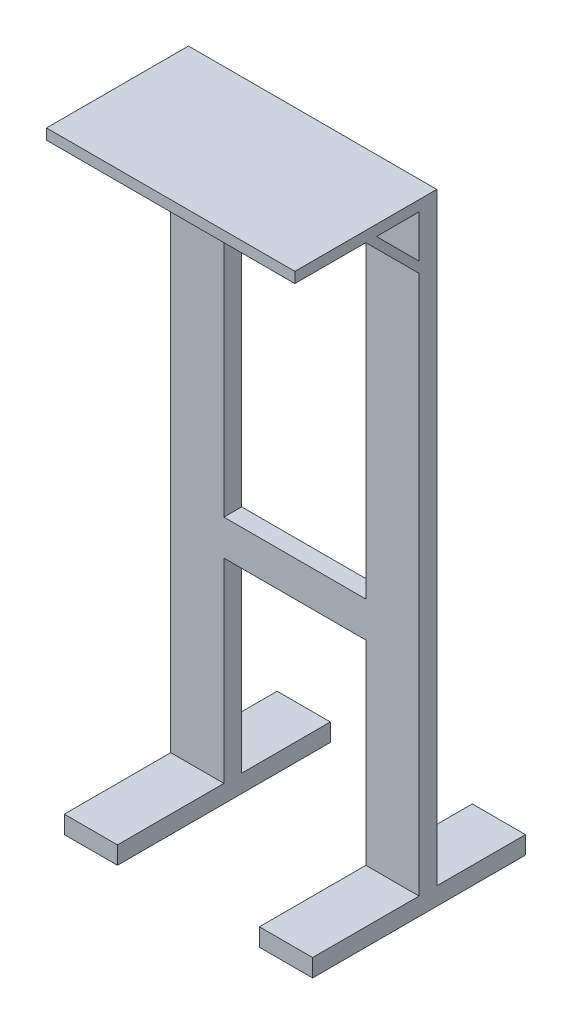
from build123d import *

# Parameters (mm, degrees)
SALIENTE_EXTRUIR1_DEPTH        = 300
SALIENTE_EXTRUIR1_DEPTH_BACK   = 300
CROQUIS1_W                     = 150
CROQUIS1_H                     = 50
SALIENTE_EXTRUIR1_2_DEPTH      = 300
SALIENTE_EXTRUIR1_2_DEPTH_BACK = 300
CROQUIS2_W                     = 150
CROQUIS2_H                     = 50
SALIENTE_EXTRUIR2_DEPTH        = 1700
CROQUIS3_W                     = 700
CROQUIS3_H                     = 100
SALIENTE_EXTRUIR3_DEPTH        = 50
CROQUIS4_W                     = 700
CROQUIS4_H                     = 30
SALIENTE_EXTRUIR4_DEPTH        = 350
SALIENTE_EXTRUIR5_DEPTH        = 15
SALIENTE_EXTRUIR6_DEPTH        = 15


with BuildPart() as part:
    # Croquis1 → Saliente-Extruir1 (new, two sides: drawn at the far end of the back side and taken through both)
    with BuildSketch(Plane.XY.offset(-SALIENTE_EXTRUIR1_DEPTH_BACK)):
        with Locations((75, 25)):
            Rectangle(CROQUIS1_W, CROQUIS1_H)
    extrude(amount=SALIENTE_EXTRUIR1_DEPTH + SALIENTE_EXTRUIR1_DEPTH_BACK)



with BuildPart() as body_2:
    # Croquis1 → Saliente-Extruir1 2 (new, two sides: drawn at the far end of the back side and taken through both)
    with BuildSketch(Plane.XY.offset(-SALIENTE_EXTRUIR1_2_DEPTH_BACK)):
        with Locations((625, 25)):
            Rectangle(CROQUIS1_W, CROQUIS1_H)
    extrude(amount=SALIENTE_EXTRUIR1_2_DEPTH + SALIENTE_EXTRUIR1_2_DEPTH_BACK)


with BuildPart() as part_1:
    add(part.part)

    add(body_2.part)  # Saliente-Extruir2 merges body 2
    # Croquis2 → Saliente-Extruir2 (add)
    with BuildSketch(Plane(origin=(0, 50, 0), x_dir=(1, 0, 0), z_dir=(0, 1, 0))):
        with Locations((75, 25)):
            Rectangle(CROQUIS2_W, CROQUIS2_H)
        with Locations((625, 25)):
            Rectangle(CROQUIS2_W, CROQUIS2_H)
    extrude(amount=SALIENTE_EXTRUIR2_DEPTH)

    # Croquis3 → Saliente-Extruir3 (add)
    with BuildSketch(Plane.XY):
        with Locations((350, 650)):
            Rectangle(CROQUIS3_W, CROQUIS3_H)
        with Locations((350, 1700)):
            Rectangle(CROQUIS3_W, CROQUIS3_H)
    extrude(amount=-SALIENTE_EXTRUIR3_DEPTH)

    # Croquis4 → Saliente-Extruir4 (add)
    with BuildSketch(Plane.XY):
        with Locations((350, 1735)):
            Rectangle(CROQUIS4_W, CROQUIS4_H)
    extrude(amount=SALIENTE_EXTRUIR4_DEPTH)

    # Croquis5 → Saliente-Extruir5 (add)
    with BuildSketch(Plane.ZY):
        Polygon((0, 1570), (150, 1720), (120, 1720), (0, 1600), align=None)
    extrude(amount=-SALIENTE_EXTRUIR5_DEPTH)

    # Croquis6 → Saliente-Extruir6 (add)
    with BuildSketch(Plane(origin=(700, 0, 0), x_dir=(0, 0, -1), z_dir=(1, 0, 0))):
        Polygon((0, 1570), (0, 1600), (-120, 1720), (-150, 1720), align=None)
    extrude(amount=-SALIENTE_EXTRUIR6_DEPTH)


solid = part_1.part
